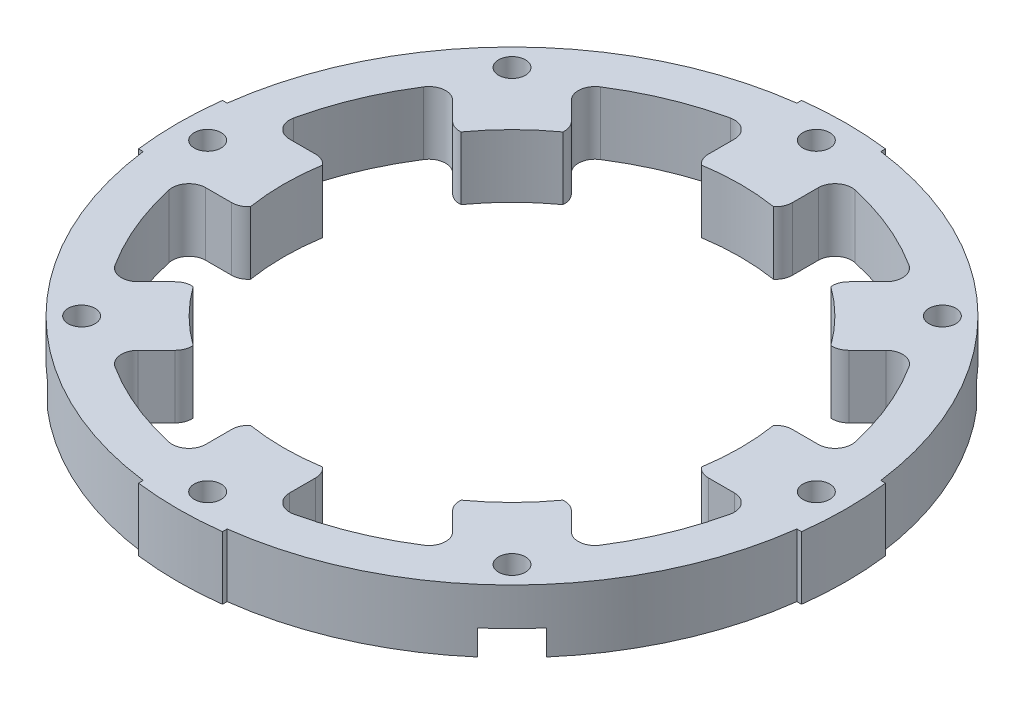
from build123d import *

# Parameters (mm, degrees)
SKETCH1_R           = 1.6
BOSS_EXTRUDE1_DEPTH = 7.5
SKETCH3_R           = 27.2
CUT_EXTRUDE1_DEPTH  = 7.5
SKETCH4_R           = 4.1
CUT_EXTRUDE2_DEPTH  = 3


with BuildPart() as part:
    # Sketch1 → Boss-Extrude1 (new body)
    with BuildSketch(Plane(origin=(0, 0, 0), x_dir=(1, 0, 0), z_dir=(0, 1, 0))):
        with BuildLine():
            Line((-5, 38.930226046), (-5, 39.484680574))
            ThreePointArc((-5, 39.484680574), (0, 39.8), (5, 39.484680574))
            Line((5, 39.484680574), (5, 38.930226046))
            ThreePointArc((5, 38.930226046), (27.753941162, 27.753941162), (38.930226046, 5))
            Line((38.930226046, 5), (39.484680574, 5))
            ThreePointArc((39.484680574, 5), (39.8, 0), (39.484680574, -5))
            Line((39.484680574, -5), (38.930226046, -5))
            ThreePointArc((38.930226046, -5), (27.753941162, -27.753941162), (5, -38.930226046))
            Line((5, -38.930226046), (5, -39.484680574))
            ThreePointArc((5, -39.484680574), (0, -39.8), (-5, -39.484680574))
            Line((-5, -39.484680574), (-5, -38.930226046))
            ThreePointArc((-5, -38.930226046), (-27.753941162, -27.753941162), (-38.930226046, -5))
            Line((-38.930226046, -5), (-39.484680574, -5))
            ThreePointArc((-39.484680574, -5), (-39.8, 0), (-39.484680574, 5))
            Line((-39.484680574, 5), (-38.930226046, 5))
            ThreePointArc((-38.930226046, 5), (-27.753941162, 27.753941162), (-5, 38.930226046))
        make_face()
        with Locations(Location((36.25, 0, 0), (0, 0, 270))):
            Circle(SKETCH1_R, mode=Mode.SUBTRACT)
        with Locations(Location((25.632620818, -25.632620818, 0), (0, 0, 270))):
            Circle(SKETCH1_R, mode=Mode.SUBTRACT)
        with Locations(Location((0, -36.25, 0), (0, 0, 270))):
            Circle(SKETCH1_R, mode=Mode.SUBTRACT)
        with Locations(Location((-25.632620818, -25.632620818, 0), (0, 0, 270))):
            Circle(SKETCH1_R, mode=Mode.SUBTRACT)
        with Locations(Location((-36.25, 0, 0), (0, 0, 270))):
            Circle(SKETCH1_R, mode=Mode.SUBTRACT)
        with Locations(Location((-25.632620818, 25.632620818, 0), (0, 0, 270))):
            Circle(SKETCH1_R, mode=Mode.SUBTRACT)
        with Locations(Location((0, 36.25, 0), (0, 0, 270))):
            Circle(SKETCH1_R, mode=Mode.SUBTRACT)
        with Locations(Location((25.632620818, 25.632620818, 0), (0, 0, 270))):
            Circle(SKETCH1_R, mode=Mode.SUBTRACT)
        with BuildLine():
            Line((28.383070994, 5), (31.481145151, 5))
            ThreePointArc((31.481145151, 5), (33.041308132, 5.748644146), (33.43346423, 7.434108527))
            ThreePointArc((33.43346423, 7.434108527), (31.642873989, 13.106907559), (28.897737827, 18.384320724))
            ThreePointArc((28.897737827, 18.384320724), (27.428638298, 19.298827781), (25.796065122, 18.72499731))
            Line((25.796065122, 18.72499731), (23.605395877, 16.534328065))
            ThreePointArc((23.605395877, 16.534328065), (22.191182314, 15.948541627), (20.776968752, 16.534328065))
            Line((20.776968752, 16.534328065), (16.534328065, 20.776968752))
            ThreePointArc((16.534328065, 20.776968752), (15.948541627, 22.191182314), (16.534328065, 23.605395877))
            Line((16.534328065, 23.605395877), (18.72499731, 25.796065122))
            ThreePointArc((18.72499731, 25.796065122), (19.298827781, 27.428638298), (18.384320724, 28.897737827))
            ThreePointArc((18.384320724, 28.897737827), (13.106907559, 31.642873989), (7.434108527, 33.43346423))
            ThreePointArc((7.434108527, 33.43346423), (5.748644146, 33.041308132), (5, 31.481145151))
            Line((5, 31.481145151), (5, 28.383070994))
            ThreePointArc((5, 28.383070994), (4.414213562, 26.968857432), (3, 26.383070994))
            Line((3, 26.383070994), (-3, 26.383070994))
            ThreePointArc((-3, 26.383070994), (-4.414213562, 26.968857432), (-5, 28.383070994))
            Line((-5, 28.383070994), (-5, 31.481145151))
            ThreePointArc((-5, 31.481145151), (-5.748644146, 33.041308132), (-7.434108527, 33.43346423))
            ThreePointArc((-7.434108527, 33.43346423), (-13.106907559, 31.642873989), (-18.384320724, 28.897737827))
            ThreePointArc((-18.384320724, 28.897737827), (-19.298827781, 27.428638298), (-18.72499731, 25.796065122))
            Line((-18.72499731, 25.796065122), (-16.534328065, 23.605395877))
            ThreePointArc((-16.534328065, 23.605395877), (-15.948541627, 22.191182314), (-16.534328065, 20.776968752))
            Line((-16.534328065, 20.776968752), (-20.776968752, 16.534328065))
            ThreePointArc((-20.776968752, 16.534328065), (-22.191182314, 15.948541627), (-23.605395877, 16.534328065))
            Line((-23.605395877, 16.534328065), (-25.796065122, 18.72499731))
            ThreePointArc((-25.796065122, 18.72499731), (-27.428638298, 19.298827781), (-28.897737827, 18.384320724))
            ThreePointArc((-28.897737827, 18.384320724), (-31.642873989, 13.106907559), (-33.43346423, 7.434108527))
            ThreePointArc((-33.43346423, 7.434108527), (-33.041308132, 5.748644146), (-31.481145151, 5))
            Line((-31.481145151, 5), (-28.383070994, 5))
            ThreePointArc((-28.383070994, 5), (-26.968857432, 4.414213562), (-26.383070994, 3))
            Line((-26.383070994, 3), (-26.383070994, -3))
            ThreePointArc((-26.383070994, -3), (-26.968857432, -4.414213562), (-28.383070994, -5))
            Line((-28.383070994, -5), (-31.481145151, -5))
            ThreePointArc((-31.481145151, -5), (-33.041308132, -5.748644146), (-33.43346423, -7.434108527))
            ThreePointArc((-33.43346423, -7.434108527), (-31.642873989, -13.106907559), (-28.897737827, -18.384320724))
            ThreePointArc((-28.897737827, -18.384320724), (-27.428638298, -19.298827781), (-25.796065122, -18.72499731))
            Line((-25.796065122, -18.72499731), (-23.605395877, -16.534328065))
            ThreePointArc((-23.605395877, -16.534328065), (-22.191182314, -15.948541627), (-20.776968752, -16.534328065))
            Line((-20.776968752, -16.534328065), (-16.534328065, -20.776968752))
            ThreePointArc((-16.534328065, -20.776968752), (-15.948541627, -22.191182314), (-16.534328065, -23.605395877))
            Line((-16.534328065, -23.605395877), (-18.72499731, -25.796065122))
            ThreePointArc((-18.72499731, -25.796065122), (-19.298827781, -27.428638298), (-18.384320724, -28.897737827))
            ThreePointArc((-18.384320724, -28.897737827), (-13.106907559, -31.642873989), (-7.434108527, -33.43346423))
            ThreePointArc((-7.434108527, -33.43346423), (-5.748644146, -33.041308132), (-5, -31.481145151))
            Line((-5, -31.481145151), (-5, -28.383070994))
            ThreePointArc((-5, -28.383070994), (-4.414213562, -26.968857432), (-3, -26.383070994))
            Line((-3, -26.383070994), (3, -26.383070994))
            ThreePointArc((3, -26.383070994), (4.414213562, -26.968857432), (5, -28.383070994))
            Line((5, -28.383070994), (5, -31.481145151))
            ThreePointArc((5, -31.481145151), (5.748644146, -33.041308132), (7.434108527, -33.43346423))
            ThreePointArc((7.434108527, -33.43346423), (13.106907559, -31.642873989), (18.384320724, -28.897737827))
            ThreePointArc((18.384320724, -28.897737827), (19.298827781, -27.428638298), (18.72499731, -25.796065122))
            Line((18.72499731, -25.796065122), (16.534328065, -23.605395877))
            ThreePointArc((16.534328065, -23.605395877), (15.948541627, -22.191182314), (16.534328065, -20.776968752))
            Line((16.534328065, -20.776968752), (20.776968752, -16.534328065))
            ThreePointArc((20.776968752, -16.534328065), (22.191182314, -15.948541627), (23.605395877, -16.534328065))
            Line((23.605395877, -16.534328065), (25.796065122, -18.72499731))
            ThreePointArc((25.796065122, -18.72499731), (27.428638298, -19.298827781), (28.897737827, -18.384320724))
            ThreePointArc((28.897737827, -18.384320724), (31.642873989, -13.106907559), (33.43346423, -7.434108527))
            ThreePointArc((33.43346423, -7.434108527), (33.041308132, -5.748644146), (31.481145151, -5))
            Line((31.481145151, -5), (28.383070994, -5))
            ThreePointArc((28.383070994, -5), (26.968857432, -4.414213562), (26.383070994, -3))
            Line((26.383070994, -3), (26.383070994, 3))
            ThreePointArc((26.383070994, 3), (26.968857432, 4.414213562), (28.383070994, 5))
        make_face(mode=Mode.SUBTRACT)
    extrude(amount=BOSS_EXTRUDE1_DEPTH)

    # Sketch3 → Cut-Extrude1 (cut)
    with BuildSketch(Plane(origin=(0, 7.5, 0), x_dir=(1, 0, 0), z_dir=(0, 1, 0))):
        Circle(SKETCH3_R)
    extrude(amount=-CUT_EXTRUDE1_DEPTH, mode=Mode.SUBTRACT)

    # Sketch4 → Cut-Extrude2 (cut)
    with BuildSketch(Plane.XZ):
        with Locations((25.632620818, -25.632620818)):
            Circle(SKETCH4_R)
        with Locations((-25.632620818, -25.632620818)):
            Circle(SKETCH4_R)
        with Locations((-25.632620818, 25.632620818)):
            Circle(SKETCH4_R)
        with Locations((25.632620818, 25.632620818)):
            Circle(SKETCH4_R)
    extrude(amount=-CUT_EXTRUDE2_DEPTH, mode=Mode.SUBTRACT)


solid = part.part
